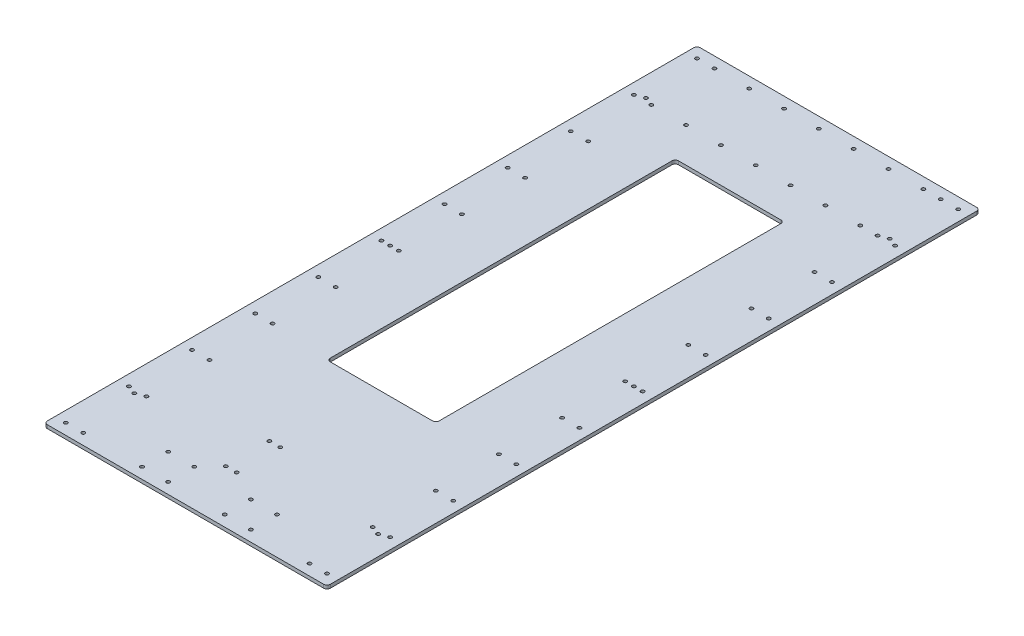
from build123d import *

# Parameters (mm, degrees)
SKETCH1_W           = 260
SKETCH1_H           = 600
SKETCH1_R           = 1.6
SKETCH1_W_2         = 100
SKETCH1_H_2         = 320
BOSS_EXTRUDE1_DEPTH = 3.175
FILLET1_R           = 3


with BuildPart() as part:
    # Sketch1 → Boss-Extrude1 (new body)
    with BuildSketch(Plane(origin=(0, 0, 0), x_dir=(1, 0, 0), z_dir=(0, 1, 0))):
        Rectangle(SKETCH1_W, SKETCH1_H)
        with Locations(Location((120, 290, 0), (0, 0, 270))):
            Circle(SKETCH1_R, mode=Mode.SUBTRACT)
        with Locations(Location((120, 232, 0), (0, 0, 270))):
            Circle(SKETCH1_R, mode=Mode.SUBTRACT)
        with Locations(Location((120, 174, 0), (0, 0, 270))):
            Circle(SKETCH1_R, mode=Mode.SUBTRACT)
        with Locations(Location((120, 116, 0), (0, 0, 270))):
            Circle(SKETCH1_R, mode=Mode.SUBTRACT)
        with Locations(Location((120, 58, 0), (0, 0, 270))):
            Circle(SKETCH1_R, mode=Mode.SUBTRACT)
        with Locations(Location((120, 0, 0), (0, 0, 270))):
            Circle(SKETCH1_R, mode=Mode.SUBTRACT)
        with Locations(Location((120, -58, 0), (0, 0, 270))):
            Circle(SKETCH1_R, mode=Mode.SUBTRACT)
        with Locations(Location((120, -116, 0), (0, 0, 270))):
            Circle(SKETCH1_R, mode=Mode.SUBTRACT)
        with Locations(Location((120, -174, 0), (0, 0, 270))):
            Circle(SKETCH1_R, mode=Mode.SUBTRACT)
        with Locations(Location((120, -232, 0), (0, 0, 270))):
            Circle(SKETCH1_R, mode=Mode.SUBTRACT)
        with Locations(Location((120, -290, 0), (0, 0, 270))):
            Circle(SKETCH1_R, mode=Mode.SUBTRACT)
        with Locations(Location((-120, 232, 0), (0, 0, 90))):
            Circle(SKETCH1_R, mode=Mode.SUBTRACT)
        with Locations(Location((-120, -290, 0), (0, 0, 90))):
            Circle(SKETCH1_R, mode=Mode.SUBTRACT)
        with Locations(Location((-120, -232, 0), (0, 0, 90))):
            Circle(SKETCH1_R, mode=Mode.SUBTRACT)
        with Locations(Location((-120, -174, 0), (0, 0, 90))):
            Circle(SKETCH1_R, mode=Mode.SUBTRACT)
        with Locations(Location((-120, -116, 0), (0, 0, 90))):
            Circle(SKETCH1_R, mode=Mode.SUBTRACT)
        with Locations(Location((-120, -58, 0), (0, 0, 90))):
            Circle(SKETCH1_R, mode=Mode.SUBTRACT)
        with Locations(Location((-120, 0, 0), (0, 0, 90))):
            Circle(SKETCH1_R, mode=Mode.SUBTRACT)
        with Locations(Location((-120, 58, 0), (0, 0, 90))):
            Circle(SKETCH1_R, mode=Mode.SUBTRACT)
        with Locations(Location((-120, 116, 0), (0, 0, 90))):
            Circle(SKETCH1_R, mode=Mode.SUBTRACT)
        with Locations(Location((-120, 174, 0), (0, 0, 90))):
            Circle(SKETCH1_R, mode=Mode.SUBTRACT)
        with Locations(Location((-120, 290, 0), (0, 0, 90))):
            Circle(SKETCH1_R, mode=Mode.SUBTRACT)
        with Locations(Location((112, 235, 0), (0, 0, 270))):
            Circle(SKETCH1_R, mode=Mode.SUBTRACT)
        with Locations(Location((-112, 235, 0), (0, 0, 90))):
            Circle(SKETCH1_R, mode=Mode.SUBTRACT)
        with Locations(Location((112, -235, 0), (0, 0, 90))):
            Circle(SKETCH1_R, mode=Mode.SUBTRACT)
        with Locations(Location((-112, -235, 0), (0, 0, 270))):
            Circle(SKETCH1_R, mode=Mode.SUBTRACT)
        with Locations(Location((104, 290, 0), (0, 0, 270))):
            Circle(SKETCH1_R, mode=Mode.SUBTRACT)
        with Locations(Location((104, 232, 0), (0, 0, 270))):
            Circle(SKETCH1_R, mode=Mode.SUBTRACT)
        with Locations(Location((104, 174, 0), (0, 0, 270))):
            Circle(SKETCH1_R, mode=Mode.SUBTRACT)
        with Locations(Location((104, 116, 0), (0, 0, 270))):
            Circle(SKETCH1_R, mode=Mode.SUBTRACT)
        with Locations(Location((104, 58, 0), (0, 0, 270))):
            Circle(SKETCH1_R, mode=Mode.SUBTRACT)
        with Locations(Location((104, 0, 0), (0, 0, 270))):
            Circle(SKETCH1_R, mode=Mode.SUBTRACT)
        with Locations(Location((104, -58, 0), (0, 0, 270))):
            Circle(SKETCH1_R, mode=Mode.SUBTRACT)
        with Locations(Location((104, -116, 0), (0, 0, 270))):
            Circle(SKETCH1_R, mode=Mode.SUBTRACT)
        with Locations(Location((104, -174, 0), (0, 0, 270))):
            Circle(SKETCH1_R, mode=Mode.SUBTRACT)
        with Locations(Location((104, -232, 0), (0, 0, 270))):
            Circle(SKETCH1_R, mode=Mode.SUBTRACT)
        with Locations(Location((104, -290, 0), (0, 0, 270))):
            Circle(SKETCH1_R, mode=Mode.SUBTRACT)
        with Locations(Location((-104, -290, 0), (0, 0, 90))):
            Circle(SKETCH1_R, mode=Mode.SUBTRACT)
        with Locations(Location((-104, -174, 0), (0, 0, 90))):
            Circle(SKETCH1_R, mode=Mode.SUBTRACT)
        with Locations(Location((-104, -116, 0), (0, 0, 90))):
            Circle(SKETCH1_R, mode=Mode.SUBTRACT)
        with Locations(Location((-104, -58, 0), (0, 0, 90))):
            Circle(SKETCH1_R, mode=Mode.SUBTRACT)
        with Locations(Location((-104, 0, 0), (0, 0, 90))):
            Circle(SKETCH1_R, mode=Mode.SUBTRACT)
        with Locations(Location((-104, 58, 0), (0, 0, 90))):
            Circle(SKETCH1_R, mode=Mode.SUBTRACT)
        with Locations(Location((-104, 116, 0), (0, 0, 90))):
            Circle(SKETCH1_R, mode=Mode.SUBTRACT)
        with Locations(Location((-104, 174, 0), (0, 0, 90))):
            Circle(SKETCH1_R, mode=Mode.SUBTRACT)
        with Locations(Location((-104, 232, 0), (0, 0, 90))):
            Circle(SKETCH1_R, mode=Mode.SUBTRACT)
        with Locations(Location((-104, 290, 0), (0, 0, 90))):
            Circle(SKETCH1_R, mode=Mode.SUBTRACT)
        with Locations(Location((-104, -232, 0), (0, 0, 90))):
            Circle(SKETCH1_R, mode=Mode.SUBTRACT)
        with Locations(Location((112, 0, 0), (0, 0, 270))):
            Circle(SKETCH1_R, mode=Mode.SUBTRACT)
        with Locations(Location((-112, 0, 0), (0, 0, 90))):
            Circle(SKETCH1_R, mode=Mode.SUBTRACT)
        with Locations(Location((-50, -290, 0), (0, 0, 270))):
            Circle(SKETCH1_R, mode=Mode.SUBTRACT)
        with Locations(Location((-50, -266, 0), (0, 0, 270))):
            Circle(SKETCH1_R, mode=Mode.SUBTRACT)
        with Locations(Location((50, -266, 0), (0, 0, 90))):
            Circle(SKETCH1_R, mode=Mode.SUBTRACT)
        with Locations(Location((50, -290, 0), (0, 0, 90))):
            Circle(SKETCH1_R, mode=Mode.SUBTRACT)
        with Locations(Location((-26, -290, 0), (0, 0, 90))):
            Circle(SKETCH1_R, mode=Mode.SUBTRACT)
        with Locations(Location((-26, -266, 0), (0, 0, 90))):
            Circle(SKETCH1_R, mode=Mode.SUBTRACT)
        with Locations(Location((26, -290, 0), (0, 0, 270))):
            Circle(SKETCH1_R, mode=Mode.SUBTRACT)
        with Locations(Location((26, -266, 0), (0, 0, 270))):
            Circle(SKETCH1_R, mode=Mode.SUBTRACT)
        with Locations(Location((-72, 290, 0), (0, 0, 90))):
            Circle(SKETCH1_R, mode=Mode.SUBTRACT)
        with Locations(Location((-72, 232, 0), (0, 0, 90))):
            Circle(SKETCH1_R, mode=Mode.SUBTRACT)
        with Locations(Location((-40, 290, 0), (0, 0, 90))):
            Circle(SKETCH1_R, mode=Mode.SUBTRACT)
        with Locations(Location((-40, 232, 0), (0, 0, 90))):
            Circle(SKETCH1_R, mode=Mode.SUBTRACT)
        with Locations(Location((-8, 290, 0), (0, 0, 90))):
            Circle(SKETCH1_R, mode=Mode.SUBTRACT)
        with Locations(Location((-8, 232, 0), (0, 0, 90))):
            Circle(SKETCH1_R, mode=Mode.SUBTRACT)
        with Locations(Location((24, 290, 0), (0, 0, 90))):
            Circle(SKETCH1_R, mode=Mode.SUBTRACT)
        with Locations(Location((24, 232, 0), (0, 0, 90))):
            Circle(SKETCH1_R, mode=Mode.SUBTRACT)
        with Locations(Location((56, 290, 0), (0, 0, 90))):
            Circle(SKETCH1_R, mode=Mode.SUBTRACT)
        with Locations(Location((56, 232, 0), (0, 0, 90))):
            Circle(SKETCH1_R, mode=Mode.SUBTRACT)
        with Locations(Location((88, 290, 0), (0, 0, 90))):
            Circle(SKETCH1_R, mode=Mode.SUBTRACT)
        with Locations(Location((88, 232, 0), (0, 0, 90))):
            Circle(SKETCH1_R, mode=Mode.SUBTRACT)
        with Locations(Location((-12, -251, 0), (0, 0, 270))):
            Circle(SKETCH1_R, mode=Mode.SUBTRACT)
        with Locations(Location((-2, -251, 0), (0, 0, 270))):
            Circle(SKETCH1_R, mode=Mode.SUBTRACT)
        with Locations(Location((-12, -211, 0), (0, 0, 90))):
            Circle(SKETCH1_R, mode=Mode.SUBTRACT)
        with Locations(Location((-2, -211, 0), (0, 0, 90))):
            Circle(SKETCH1_R, mode=Mode.SUBTRACT)
        with Locations((0, 40)):
            Rectangle(SKETCH1_W_2, SKETCH1_H_2, mode=Mode.SUBTRACT)
    extrude(amount=BOSS_EXTRUDE1_DEPTH)

    # Fillet1
    fillet1_edges = [part.edges().sort_by_distance(p)[0] for p in [
        (50, 1.5875, 120),
        (50, 1.5875, -200),
        (-50, 1.5875, -200),
        (-50, 1.5875, 120),
        (130, 1.5875, 300),
        (-130, 1.5875, 300),
        (-130, 1.5875, -300),
        (130, 1.5875, -300),
    ]]
    fillet(fillet1_edges, radius=FILLET1_R)


solid = part.part
